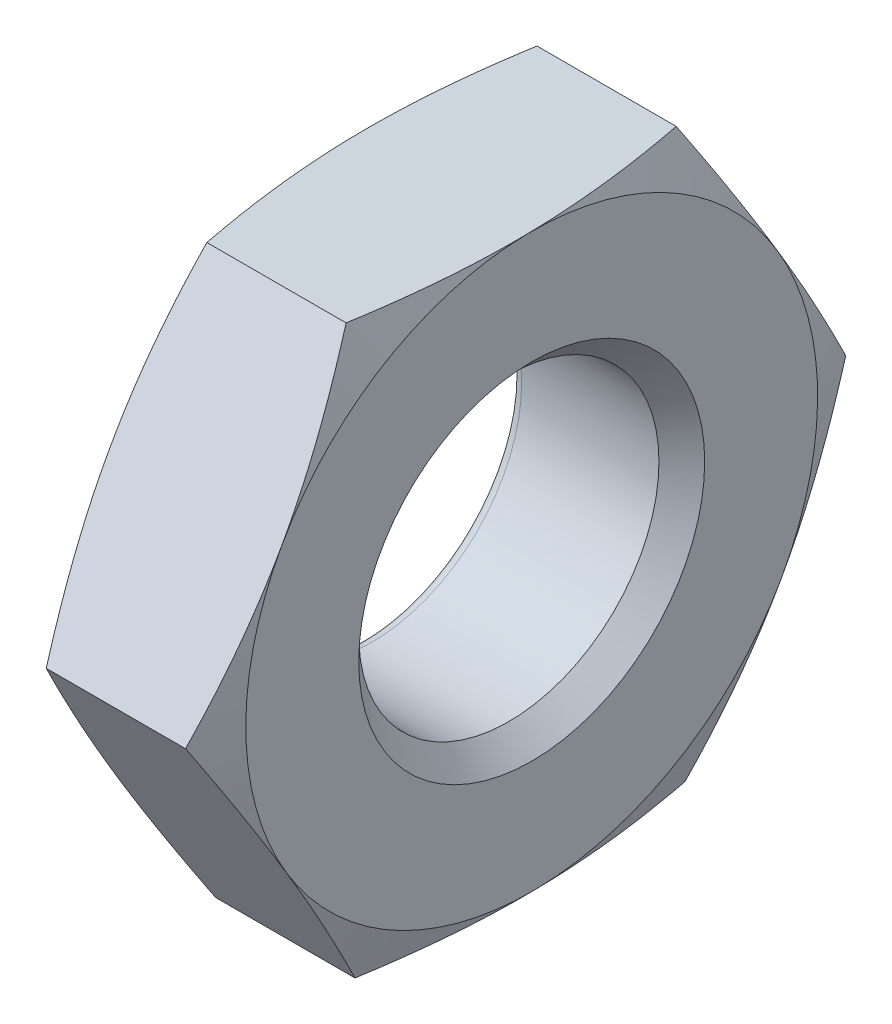
from build123d import *

# Parameters (mm, degrees)
RESSALTO_EXTRUS_O1_DEPTH = 3
FILETE1_R                = 0.2
ESBO_O12_OUTSIDE_W       = 88.106
ESBO_O12_OUTSIDE_H       = 86.648
ESBO_O12_OUTSIDE_R       = 5
CORTE_EXTRUS_O3_DEPTH    = 13
CORTE_EXTRUS_O3_DRAFT    = -70
ESBO_O17_OUTSIDE_W       = 88.106
ESBO_O17_OUTSIDE_H       = 86.648
ESBO_O17_OUTSIDE_R       = 4.994498725
CORTE_EXTRUS_O4_DEPTH    = 13
CORTE_EXTRUS_O4_DRAFT    = -70


with BuildPart() as part:
    # Esboço1 → Ressalto-extrusão1 (new body)
    with BuildSketch(Plane(origin=(0, 0, 0), x_dir=(0, 0, -1), z_dir=(1, 0, 0))):
        Polygon((2.808721651, 5.044245833), (-2.964084209, 4.954547218), (-5.77280586, -0.089698615), (-2.808721651, -5.044245833), (2.964084209, -4.954547218), (5.77280586, 0.089698615), align=None)
    extrude(amount=RESSALTO_EXTRUS_O1_DEPTH)

    # Esboço11 → Furo roscado de M6x0.752 (revolve, cut)
    with BuildSketch(Plane(origin=(3, 0, 0), x_dir=(0, 0, -1), z_dir=(0, 1, 0))):
        Polygon((0, 0), (0, 3), (2.625, 3), (2.625, 0.4), (3.025, 0), align=None)
    revolve(axis=Axis((9.35, 0, 0), (-1, 0, 0)), mode=Mode.SUBTRACT)

    # Filete1
    filete1_edges = [part.edges().sort_by_distance(p)[0] for p in [
        (0, 0, 2.625),
    ]]
    fillet(filete1_edges, radius=FILETE1_R)


with BuildPart() as corte_extrus_o3_tool:
    # Esboço12 outside → Corte-extrusão3 (with draft: the straight prism first)
    with BuildSketch(Plane(origin=(3, 0, 0), x_dir=(0, 0, -1), z_dir=(1, 0, 0))):
        Rectangle(ESBO_O12_OUTSIDE_W, ESBO_O12_OUTSIDE_H)
        Circle(ESBO_O12_OUTSIDE_R, mode=Mode.SUBTRACT)
    extrude(amount=-CORTE_EXTRUS_O3_DEPTH)
    # Corte-extrusão3: the draft: its side faces are tilted about the plane it starts from
    corte_extrus_o3_sides = [corte_extrus_o3_tool.faces().sort_by_distance(p)[0] for p in [
        (-3.5, -43.324, 0),
        (-3.5, 0, -44.053),
        (-3.5, 43.324, 0),
        (-3.5, 0, 44.053),
        (-3.5, 0, 5),
    ]]
    draft(corte_extrus_o3_sides, Plane(origin=(3, 0, 0), x_dir=(0, 0, -1), z_dir=(1, 0, 0)), CORTE_EXTRUS_O3_DRAFT)


with BuildPart() as part_1:
    add(part.part)

    # Corte-extrusão3: cut by corte_extrus_o3_tool
    add(corte_extrus_o3_tool.part, mode=Mode.SUBTRACT)


with BuildPart() as corte_extrus_o4_tool:
    # Esboço17 outside → Corte-extrusão4 (with draft: the straight prism first)
    with BuildSketch(Plane.ZY):
        Rectangle(ESBO_O17_OUTSIDE_W, ESBO_O17_OUTSIDE_H)
        Circle(ESBO_O17_OUTSIDE_R, mode=Mode.SUBTRACT)
    extrude(amount=-CORTE_EXTRUS_O4_DEPTH)
    # Corte-extrusão4: the draft: its side faces are tilted about the plane it starts from
    corte_extrus_o4_sides = [corte_extrus_o4_tool.faces().sort_by_distance(p)[0] for p in [
        (6.5, -43.324, 0),
        (6.5, 0, 44.053),
        (6.5, 43.324, 0),
        (6.5, 0, -44.053),
        (6.5, 0, -4.994498725),
    ]]
    draft(corte_extrus_o4_sides, Plane.ZY, CORTE_EXTRUS_O4_DRAFT)


with BuildPart() as part_2:
    add(part_1.part)

    # Corte-extrusão4: cut by corte_extrus_o4_tool
    add(corte_extrus_o4_tool.part, mode=Mode.SUBTRACT)


solid = part_2.part
